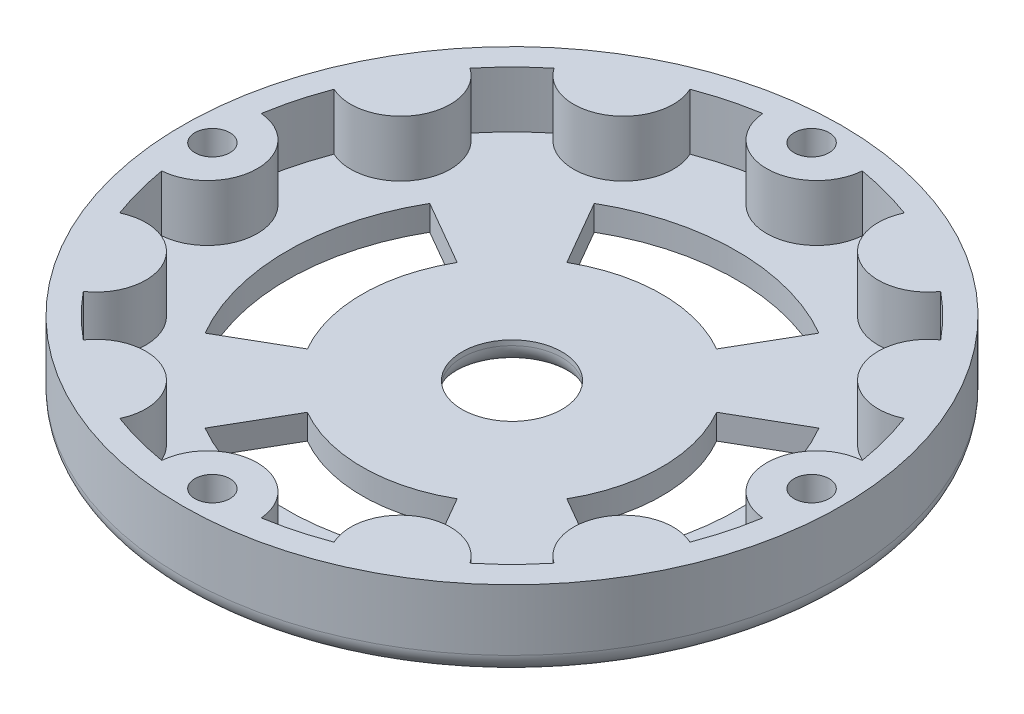
from build123d import *

# Parameters (mm, degrees)
SKETCH1_R           = 41.91
BOSS_EXTRUDE3_DEPTH = 7.1501
BOSS_EXTRUDE4_START = -3.175
SKETCH1_8_R         = 41.91
BOSS_EXTRUDE4_DEPTH = 3.175
SKETCH3_R           = 6.35
CUT_EXTRUDE1_DEPTH  = 10.3251
CIRPATTERN1_COUNT   = 12
FILLET1_R           = 2.54
CUT_EXTRUDE2_REACH  = 62.162
SKETCH4_R           = 2.2225
CIRPATTERN2_COUNT   = 4
SCALE1_SCALE        = 2
CUT_EXTRUDE3_START  = -6.350001
CUT_EXTRUDE3_DEPTH  = 20.6502
CIRPATTERN3_COUNT   = 4
SCALE2_SCALE        = 0.5


with BuildPart() as part:
    # Sketch1 → Boss-Extrude3 (new body)
    with BuildSketch(Plane(origin=(0, 0, 0), x_dir=(1, 0, 0), z_dir=(0, 1, 0))):
        with Locations(Location((0, 0, 0), (0, 0, 270))):
            Circle(SKETCH1_R)
        with BuildLine():
            ThreePointArc((6.328632418, 38.214508197), (0, -38.735), (-6.328632418, 38.214508197))
            ThreePointArc((-6.328632418, 38.214508197), (0, 32.385), (6.328632418, 38.214508197))
        make_face(mode=Mode.SUBTRACT)
    boss_extrude3 = extrude(amount=BOSS_EXTRUDE3_DEPTH)

    # Sketch1<8> → Boss-Extrude4 (add)
    with BuildSketch(Plane(origin=(0, 0, 0), x_dir=(1, 0, 0), z_dir=(0, 1, 0)).offset(BOSS_EXTRUDE4_START)):
        with Locations(Location((0, 0, 0), (0, 0, 270))):
            Circle(SKETCH1_8_R)
    extrude(amount=BOSS_EXTRUDE4_DEPTH)

    # Sketch3 → Cut-Extrude1 (cut)
    with BuildSketch(Plane.XZ.offset(-7.1501)):
        with Locations(Location((0, 0, 0), (0, 0, 90))):
            Circle(SKETCH3_R)
    extrude(amount=CUT_EXTRUDE1_DEPTH, mode=Mode.SUBTRACT)

    # CirPattern1: Boss-Extrude3 ×12 about axis
    cirpattern1_axis = Axis((0, 0, 0), (0, 1, 0))
    for i in range(1, CIRPATTERN1_COUNT):
        add(boss_extrude3.rotate(cirpattern1_axis, i * 360 / CIRPATTERN1_COUNT))

    # Fillet1
    fillet1_edges = [part.edges().sort_by_distance(p)[0] for p in [
        (0, -3.175, -41.91),
        (0, -3.175, -6.35),
    ]]
    fillet(fillet1_edges, radius=FILLET1_R)

    # Cut-Extrude2: up to this face of the body (flat: up to its plane)
    cut_extrude2_end = Plane(part.part.faces().sort_by_distance((0, -3.175, -38.256448241))[0])
    # Sketch4 → Cut-Extrude2 (cut, up to the picked face)
    with BuildSketch(Plane(origin=(0, 7.1501, 0), x_dir=(1, 0, 0), z_dir=(0, 1, 0)), mode=Mode.PRIVATE) as cut_extrude2_sk1:
        with Locations(Location((0, 38.1, 0), (0, 0, 270))):
            Circle(SKETCH4_R)
    cut_extrude2_tool1 = split(extrude(cut_extrude2_sk1.sketch, amount=-CUT_EXTRUDE2_REACH, mode=Mode.PRIVATE), bisect_by=cut_extrude2_end, keep=Keep.BOTH, mode=Mode.PRIVATE)
    cut_extrude2 = cut_extrude2_tool1.solids().sort_by(Axis((0, 7.1501, -38.1), (0, -1, 0)))[0]
    add(cut_extrude2, mode=Mode.SUBTRACT)

    # CirPattern2: Cut-Extrude2 ×4 about axis
    cirpattern2_axis = Axis((0, 0, 0), (0, 1, 0))
    for i in range(1, CIRPATTERN2_COUNT):
        add(cut_extrude2.rotate(cirpattern2_axis, i * 360 / CIRPATTERN2_COUNT), mode=Mode.SUBTRACT)


with BuildPart() as part_1:
    # Scale1: scaled about (-1.3e-08, 0.44206654, 1e-09)
    add(part.part.scale(SCALE1_SCALE).moved(Location((1.3e-08, -0.44206654, -1e-09))))

    # Sketch5 → Cut-Extrude3 (cut)
    with BuildSketch(Plane(origin=(0, -0.442065876, 0), x_dir=(1, 0, 0), z_dir=(0, 1, 0)).offset(CUT_EXTRUDE3_START)):
        with BuildLine():
            Line((-19.05, 32.995567884), (-28.575, 49.493351826))
            ThreePointArc((-28.575, 49.493351826), (0, 57.15), (28.575, 49.493351826))
            Line((28.575, 49.493351826), (19.05, 32.995567884))
            ThreePointArc((19.05, 32.995567884), (0, 38.1), (-19.05, 32.995567884))
        make_face()
    cut_extrude3 = extrude(amount=CUT_EXTRUDE3_DEPTH, mode=Mode.SUBTRACT)

    # CirPattern3: Cut-Extrude3 ×4 about axis
    cirpattern3_axis = Axis((0, -6.792065876, 0), (0, 1, 0))
    for i in range(1, CIRPATTERN3_COUNT):
        add(cut_extrude3.rotate(cirpattern3_axis, i * 360 / CIRPATTERN3_COUNT), mode=Mode.SUBTRACT)


with BuildPart() as part_2:
    # Scale2: scaled about (-1.4e-08, 0.951448261, 2e-09)
    add(part_1.part.scale(SCALE2_SCALE).moved(Location((-7e-09, 0.475724131, 1e-09))))


solid = part_2.part
